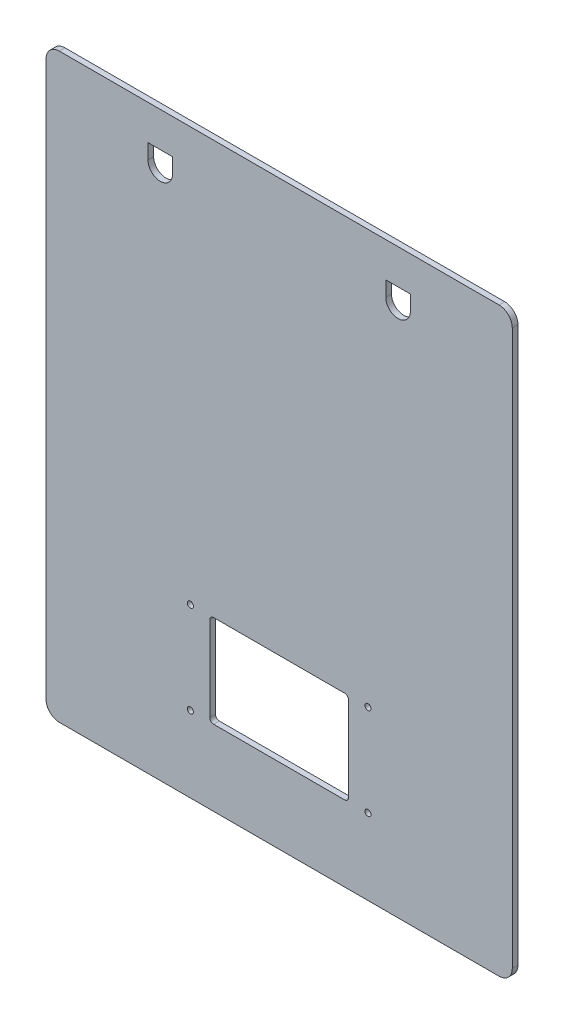
from build123d import *

# Parameters (mm, degrees)
BOSS_EXTRU_1_DEPTH      = 3
ENL_V_MAT_EXTRU_1_DEPTH = 395.818945847
ESQUISSE3_R             = 1.6
ENL_V_MAT_EXTRU_2_DEPTH = 395.818945847


with BuildPart() as part:
    # Esquisse1 → Boss.-Extru.1 (new body)
    with BuildSketch(Plane.XY):
        with BuildLine():
            Line((7, 0), (240, 0))
            ThreePointArc((240, 0), (244.949747468, 2.050252532), (247, 7))
            Line((247, 7), (247, 301))
            ThreePointArc((247, 301), (244.949747468, 305.949747468), (240, 308))
            Line((240, 308), (7, 308))
            ThreePointArc((7, 308), (2.050252532, 305.949747468), (0, 301))
            Line((0, 301), (0, 7))
            ThreePointArc((0, 7), (2.050252532, 2.050252532), (7, 0))
        make_face()
    extrude(amount=BOSS_EXTRU_1_DEPTH)

    # Esquisse2 → Enlèv. mat.-Extru.1 (cut, through all)
    with BuildSketch(Plane(origin=(0, 0, 0), x_dir=(-1, 0, 0), z_dir=(0, 0, -1))):
        with BuildLine():
            Line((-54, 289.5), (-67, 289.5))
            Line((-67, 289.5), (-67, 281.5))
            ThreePointArc((-67, 281.5), (-60.5, 275), (-54, 281.5))
            Line((-54, 281.5), (-54, 289.5))
        make_face()
        with BuildLine():
            Line((-193, 289.5), (-193, 281.5))
            ThreePointArc((-193, 281.5), (-186.5, 275), (-180, 281.5))
            Line((-180, 281.5), (-180, 289.5))
            Line((-180, 289.5), (-180, 289.526253408))
            Line((-180, 289.526253408), (-193, 289.526253408))
            Line((-193, 289.526253408), (-193, 289.5))
        make_face()
    extrude(amount=-ENL_V_MAT_EXTRU_1_DEPTH, mode=Mode.SUBTRACT)

    # Esquisse3 → Enlèv. mat.-Extru.2 (cut, through all)
    with BuildSketch(Plane(origin=(0, 0, 0), x_dir=(-1, 0, 0), z_dir=(0, 0, -1))):
        with Locations((-170.55, 88.75)):
            Circle(ESQUISSE3_R)
        with Locations(Location((-76.45, 40.21, 0), (0, 0, 180))):
            Circle(ESQUISSE3_R)
        with Locations((-170.55, 40.21)):
            Circle(ESQUISSE3_R)
        with Locations(Location((-76.45, 88.75, 0), (0, 0, 180))):
            Circle(ESQUISSE3_R)
        with BuildLine():
            Line((-158.22, 88.96), (-88.78, 88.96))
            ThreePointArc((-88.78, 88.96), (-87.365786438, 88.374213562), (-86.78, 86.96))
            Line((-86.78, 86.96), (-86.78, 42))
            ThreePointArc((-86.78, 42), (-87.365786438, 40.585786438), (-88.78, 40))
            Line((-88.78, 40), (-158.22, 40))
            ThreePointArc((-158.22, 40), (-159.634213562, 40.585786438), (-160.22, 42))
            Line((-160.22, 42), (-160.22, 86.96))
            ThreePointArc((-160.22, 86.96), (-159.634213562, 88.374213562), (-158.22, 88.96))
        make_face()
    extrude(amount=-ENL_V_MAT_EXTRU_2_DEPTH, mode=Mode.SUBTRACT)


solid = part.part
